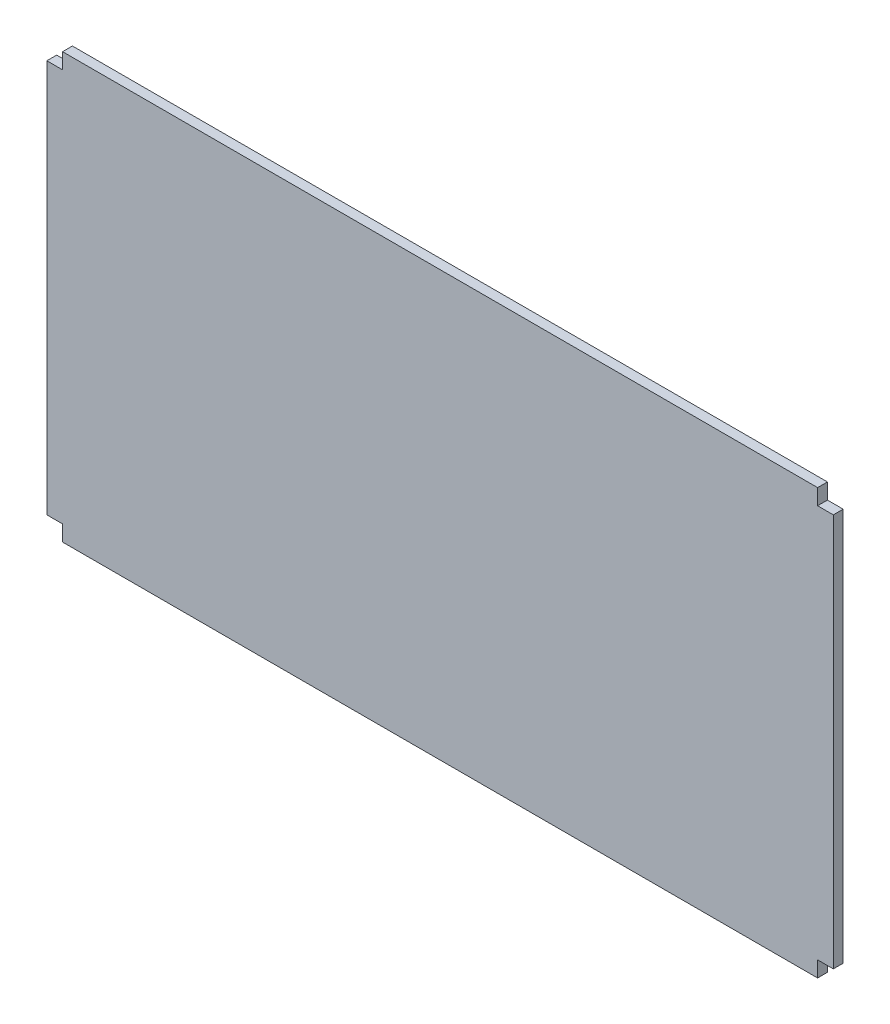
from build123d import *

# Parameters (mm, degrees)
BOSS_EXTRUDE1_DEPTH = 12.5


with BuildPart() as part:
    # Sketch1 → Boss-Extrude1 (new body)
    with BuildSketch(Plane.XY):
        Polygon((-500, 125), (-480, 125), (-480, 145), (480, 145), (480, 125), (500, 125), (500, -375), (480, -375), (480, -395), (-480, -395), (-480, -375), (-500, -375), (-500, -155), align=None)
    extrude(amount=BOSS_EXTRUDE1_DEPTH)


solid = part.part
